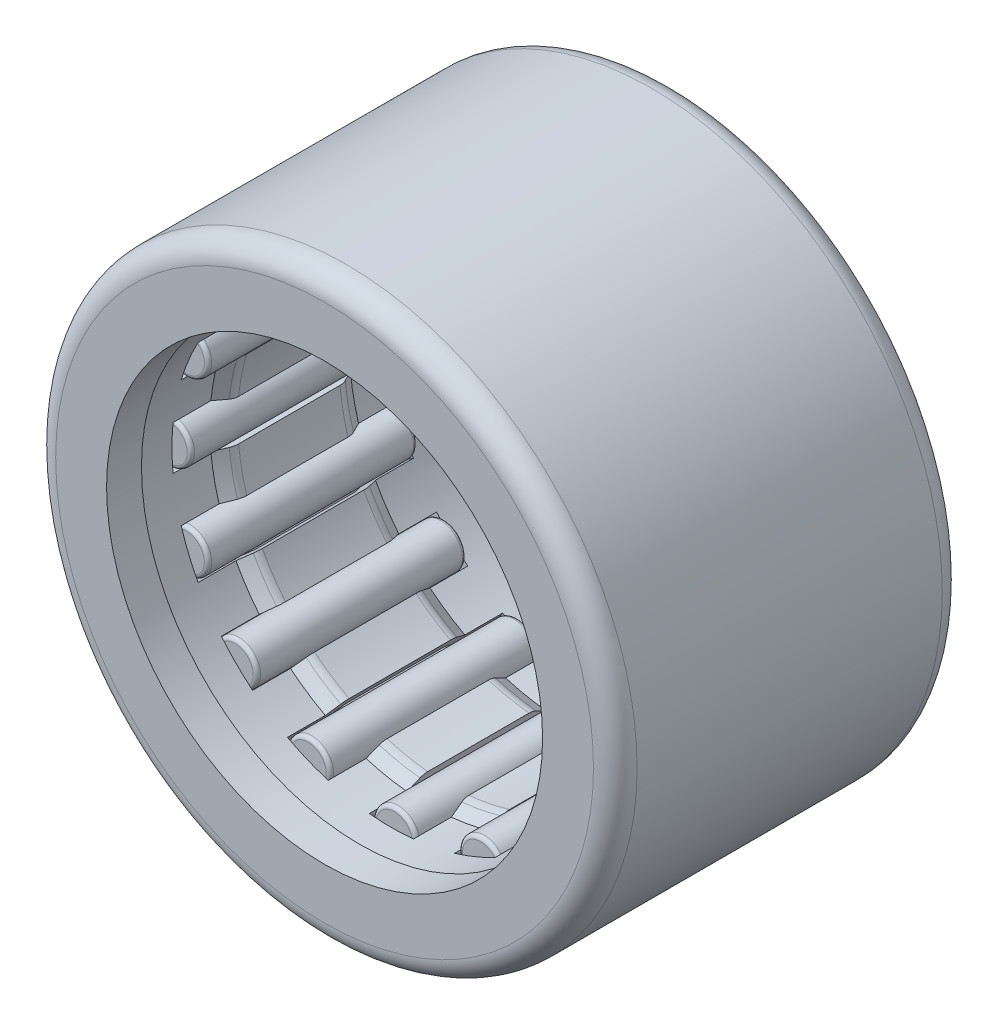
from build123d import *

# Parameters (mm, degrees)
FILLET1_R          = 0.75
SKETCH4_W          = 7.2
SKETCH4_H          = 0.75
FILLET2_R          = 0.127
CIRPATTERN1_COUNT  = 16
FILLET3_R          = 0.508
CUT_EXTRUDE1_DEPTH = 3.7016
CIRPATTERN2_COUNT  = 16


with BuildPart() as part:
    # Sketch3 → Revolve1 (revolve)
    with BuildSketch(Plane(origin=(0, 0, 0), x_dir=(0, 0, -1), z_dir=(1, 0, 0)), mode=Mode.PRIVATE) as revolve1_sk:
        Polygon((4.8, 9), (4.8, 7.5), (6, 7.5), (6, 10), (-6, 10), (-6, 7.5), (-4.8, 7.5), (-4.8, 9), align=None)
    revolve(revolve1_sk.sketch.rotate(Axis((0, 0, 6), (0, 0, -1)), 90), axis=Axis((0, 0, 6), (0, 0, -1)))

    # Fillet1
    fillet1_edges = [part.edges().sort_by_distance(p)[0] for p in [
        (-10, 0, -6),
        (-10, 0, 6),
    ]]
    fillet(fillet1_edges, radius=FILLET1_R)


with BuildPart() as body_2:
    # Sketch4 → Revolve2 (revolve)
    with BuildSketch(Plane(origin=(0, 0, 0), x_dir=(0, 0, -1), z_dir=(1, 0, 0))):
        with Locations((0, 7.375)):
            Rectangle(SKETCH4_W, SKETCH4_H)
    revolve(axis=Axis((0, 7.75, 3.6), (0, 0, -1)))

    # Fillet2
    fillet2_edges = [body_2.edges().sort_by_distance(p)[0] for p in [
        (0, 8.5, 3.6),
        (0, 8.5, -3.6),
    ]]
    fillet(fillet2_edges, radius=FILLET2_R)


with BuildPart() as cirpattern1_1:
    # CirPattern1: pattern copy
    add(body_2.part.rotate(Axis((0, 0, 0), (0, 0, 1)), 1 * 360 / CIRPATTERN1_COUNT))


with BuildPart() as cirpattern1_2:
    # CirPattern1: pattern copy
    add(body_2.part.rotate(Axis((0, 0, 0), (0, 0, 1)), 2 * 360 / CIRPATTERN1_COUNT))


with BuildPart() as cirpattern1_3:
    # CirPattern1: pattern copy
    add(body_2.part.rotate(Axis((0, 0, 0), (0, 0, 1)), 3 * 360 / CIRPATTERN1_COUNT))


with BuildPart() as cirpattern1_4:
    # CirPattern1: pattern copy
    add(body_2.part.rotate(Axis((0, 0, 0), (0, 0, 1)), 4 * 360 / CIRPATTERN1_COUNT))


with BuildPart() as cirpattern1_5:
    # CirPattern1: pattern copy
    add(body_2.part.rotate(Axis((0, 0, 0), (0, 0, 1)), 5 * 360 / CIRPATTERN1_COUNT))


with BuildPart() as cirpattern1_6:
    # CirPattern1: pattern copy
    add(body_2.part.rotate(Axis((0, 0, 0), (0, 0, 1)), 6 * 360 / CIRPATTERN1_COUNT))


with BuildPart() as cirpattern1_7:
    # CirPattern1: pattern copy
    add(body_2.part.rotate(Axis((0, 0, 0), (0, 0, 1)), 7 * 360 / CIRPATTERN1_COUNT))


with BuildPart() as cirpattern1_8:
    # CirPattern1: pattern copy
    add(body_2.part.rotate(Axis((0, 0, 0), (0, 0, 1)), 8 * 360 / CIRPATTERN1_COUNT))


with BuildPart() as cirpattern1_9:
    # CirPattern1: pattern copy
    add(body_2.part.rotate(Axis((0, 0, 0), (0, 0, 1)), 9 * 360 / CIRPATTERN1_COUNT))


with BuildPart() as cirpattern1_10:
    # CirPattern1: pattern copy
    add(body_2.part.rotate(Axis((0, 0, 0), (0, 0, 1)), 10 * 360 / CIRPATTERN1_COUNT))


with BuildPart() as cirpattern1_11:
    # CirPattern1: pattern copy
    add(body_2.part.rotate(Axis((0, 0, 0), (0, 0, 1)), 11 * 360 / CIRPATTERN1_COUNT))


with BuildPart() as cirpattern1_12:
    # CirPattern1: pattern copy
    add(body_2.part.rotate(Axis((0, 0, 0), (0, 0, 1)), 12 * 360 / CIRPATTERN1_COUNT))


with BuildPart() as cirpattern1_13:
    # CirPattern1: pattern copy
    add(body_2.part.rotate(Axis((0, 0, 0), (0, 0, 1)), 13 * 360 / CIRPATTERN1_COUNT))


with BuildPart() as cirpattern1_14:
    # CirPattern1: pattern copy
    add(body_2.part.rotate(Axis((0, 0, 0), (0, 0, 1)), 14 * 360 / CIRPATTERN1_COUNT))


with BuildPart() as cirpattern1_15:
    # CirPattern1: pattern copy
    add(body_2.part.rotate(Axis((0, 0, 0), (0, 0, 1)), 15 * 360 / CIRPATTERN1_COUNT))


with BuildPart() as body_18:
    # Sketch6 → Revolve3 (revolve)
    with BuildSketch(Plane(origin=(0, 0, 0), x_dir=(0, 0, -1), z_dir=(1, 0, 0)), mode=Mode.PRIVATE) as revolve3_sk:
        Polygon((-4.8, 7.5508), (-4.8, 8.25), (-2.916382081, 8.25), (-1.705332156, 7.5508), (1.705332156, 7.5508), (2.916382081, 8.25), (4.8, 8.25), (4.8, 7.5508), (2.4, 7.5508), (1.878999117, 7.25), (-1.878999117, 7.25), (-2.4, 7.5508), align=None)
    revolve(revolve3_sk.sketch.rotate(Axis((0, 0, 6), (0, 0, -1)), 90), axis=Axis((0, 0, 6), (0, 0, -1)))

    # Fillet3
    fillet3_edges = [body_18.edges().sort_by_distance(p)[0] for p in [
        (-7.25, 0, -1.878999117),
        (-7.25, 0, 1.878999117),
    ]]
    fillet(fillet3_edges, radius=FILLET3_R)

    # Sketch7 → Cut-Extrude1 (cut, symmetric)
    with BuildSketch(Plane.XY):
        Polygon((-0.659597354, 6.9492), (0.659597354, 6.9492), (0.942002646, 8.5508), (-0.942002646, 8.5508), align=None)
    cut_extrude1 = extrude(amount=CUT_EXTRUDE1_DEPTH, both=True, mode=Mode.SUBTRACT)

    # CirPattern2: Cut-Extrude1 ×16 about axis
    cirpattern2_axis = Axis((0, 0, 0), (0, 0, 1))
    for i in range(1, CIRPATTERN2_COUNT):
        add(cut_extrude1.rotate(cirpattern2_axis, i * 360 / CIRPATTERN2_COUNT), mode=Mode.SUBTRACT)


solid = Compound([part.part, body_2.part, cirpattern1_1.part, cirpattern1_2.part, cirpattern1_3.part, cirpattern1_4.part, cirpattern1_5.part, cirpattern1_6.part, cirpattern1_7.part, cirpattern1_8.part, cirpattern1_9.part, cirpattern1_10.part, cirpattern1_11.part, cirpattern1_12.part, cirpattern1_13.part, cirpattern1_14.part, cirpattern1_15.part, body_18.part])
